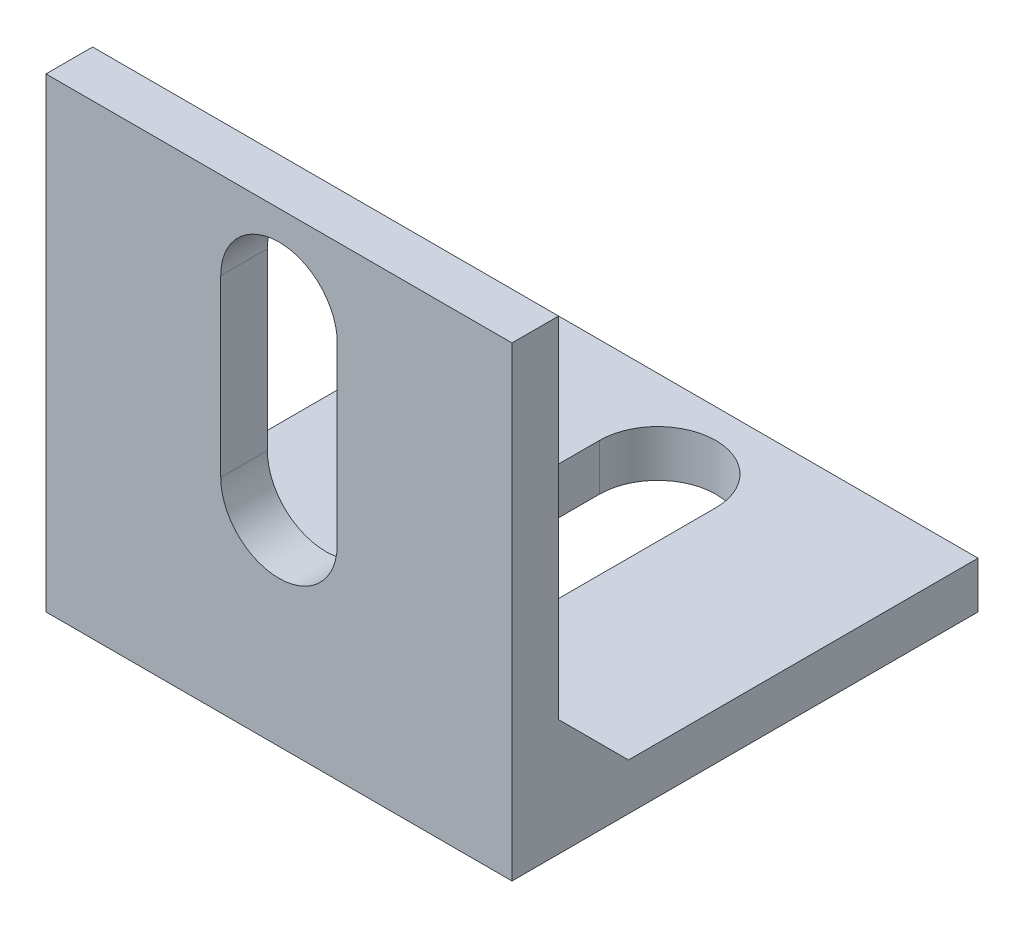
from build123d import *

# Parameters (mm, degrees)
BODY_DEPTH          = 10
FIXATION_HOLE_DEPTH = 29.705400189


with BuildPart() as part:
    # Sketch1 → Body (new, symmetric)
    with BuildSketch(Plane(origin=(0, 0, 0), x_dir=(0, 0, -1), z_dir=(1, 0, 0))):
        Polygon((20, 0), (0, 0), (0, 20), (2, 20), (2, 5), (5, 2), (20, 2), align=None)
    extrude(amount=BODY_DEPTH, both=True)

    # Sketch3 → Fixation_Hole (cut, through all)
    with BuildSketch(Plane(origin=(0, 0, -2), x_dir=(-1, 0, 0), z_dir=(0, 0, -1))):
        with BuildLine():
            Line((-2.5, 8.75), (-2.5, 16.25))
            ThreePointArc((-2.5, 16.25), (0, 18.75), (2.5, 16.25))
            Line((2.5, 16.25), (2.5, 8.75))
            ThreePointArc((2.5, 8.75), (0, 6.25), (-2.5, 8.75))
        make_face()
    fixation_hole = extrude(amount=-FIXATION_HOLE_DEPTH, mode=Mode.SUBTRACT)

    # Mirror1: Fixation_Hole across plane
    add(fixation_hole.mirror(Plane(origin=(0, 0, 0), x_dir=(0, -0.7071067811865476, 0.7071067811865475), z_dir=(0, -0.7071067811865475, -0.7071067811865476))), mode=Mode.SUBTRACT)


solid = part.part
